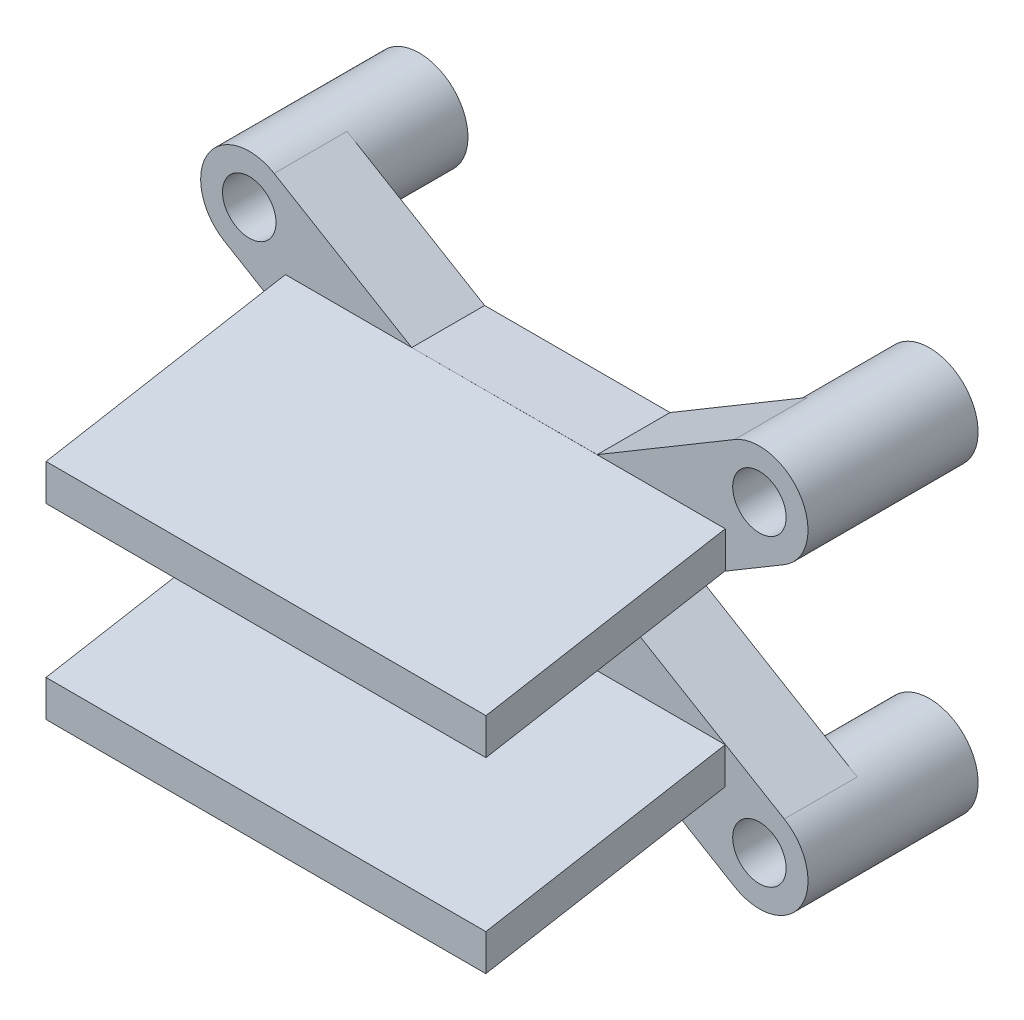
from build123d import *

# Parameters (mm, degrees)
CROQUIS1_R                   = 1.1
SALIENTE_EXTRUIR1_DEPTH      = 3
SALIENTE_EXTRUIR2_START      = 4
CROQUIS2_R                   = 2
CROQUIS2_R_2                 = 1.1
SALIENTE_EXTRUIR2_DEPTH      = 4
SALIENTE_EXTRUIR3_DEPTH      = 3
SALIENTE_EXTRUIR4_DEPTH      = 12.9
SALIENTE_EXTRUIR4_DEPTH_BACK = 5.2


with BuildPart() as part:
    # Croquis1 → Saliente-Extruir1 (new body)
    with BuildSketch(Plane.XY):
        with BuildLine():
            ThreePointArc((-1.022968, 1.718586), (-1.718586, -1.022968), (1.022968, -1.718586))
            Line((1.022968, -1.718586), (10.505387, 3.925711))
            Line((10.505387, 3.925711), (19.976173, -1.718074))
            ThreePointArc((19.976173, -1.718074), (22.718074, -1.023827), (22.023827, 1.718074))
            Line((22.023827, 1.718074), (14.41452, 6.252576))
            Line((14.41452, 6.252576), (22.022968, 10.781414))
            ThreePointArc((22.022968, 10.781414), (22.718586, 13.522968), (19.977032, 14.218586))
            Line((19.977032, 14.218586), (10.506551, 8.581394))
            Line((10.506551, 8.581394), (1.03008, 14.228567))
            ThreePointArc((1.03008, 14.228567), (-1.711821, 13.53432), (-1.017574, 10.792419))
            Line((-1.017574, 10.792419), (6.597418, 6.25453))
            Line((6.597418, 6.25453), (-1.022968, 1.718586))
        make_face()
        Circle(CROQUIS1_R, mode=Mode.SUBTRACT)
        with Locations((21, 0)):
            Circle(CROQUIS1_R, mode=Mode.SUBTRACT)
        with Locations((0.006253, 12.510493)):
            Circle(CROQUIS1_R, mode=Mode.SUBTRACT)
        with Locations((21, 12.5)):
            Circle(CROQUIS1_R, mode=Mode.SUBTRACT)
    extrude(amount=SALIENTE_EXTRUIR1_DEPTH)

    # Croquis2 → Saliente-Extruir2 (add)
    # profile 1 of 4: a face of its own
    with BuildSketch(Plane(origin=(0, 0, 0), x_dir=(-1, 0, 0), z_dir=(0, 0, -1)).offset(SALIENTE_EXTRUIR2_START)):
        with Locations((-0.006253, 12.510493)):
            Circle(CROQUIS2_R)
        with Locations((-0.006253, 12.510493)):
            Circle(CROQUIS2_R_2, mode=Mode.SUBTRACT)
    # profile 2 of 4: a face of its own
    with BuildSketch(Plane(origin=(0, 0, 0), x_dir=(-1, 0, 0), z_dir=(0, 0, -1)).offset(SALIENTE_EXTRUIR2_START)):
        with Locations((-21, 0)):
            Circle(CROQUIS2_R)
        with Locations((-21, 0)):
            Circle(CROQUIS2_R_2, mode=Mode.SUBTRACT)
    # profile 3 of 4: a face of its own
    with BuildSketch(Plane(origin=(0, 0, 0), x_dir=(-1, 0, 0), z_dir=(0, 0, -1)).offset(SALIENTE_EXTRUIR2_START)):
        with Locations((-21, 12.5)):
            Circle(CROQUIS2_R)
        with Locations((-21, 12.5)):
            Circle(CROQUIS2_R_2, mode=Mode.SUBTRACT)
    # profile 4 of 4: a face of its own
    with BuildSketch(Plane(origin=(0, 0, 0), x_dir=(-1, 0, 0), z_dir=(0, 0, -1)).offset(SALIENTE_EXTRUIR2_START)):
        Circle(CROQUIS2_R)
        Circle(CROQUIS2_R_2, mode=Mode.SUBTRACT)
    extrude(amount=-SALIENTE_EXTRUIR2_DEPTH)

    # Croquis3 → Saliente-Extruir3 (add)
    with BuildSketch(Plane.XY.offset(3)):
        Polygon((9.208161, 9.353553), (9.210798, 9.353553), (6.693662, 10.853553), (6.688161, 10.853553), (1.708161, 10.792419), (1.708161, 9.353553), align=None)
        Polygon((6.693662, 10.853553), (9.210798, 9.353553), (11.803777, 9.353553), (14.323777, 10.853553), align=None)
        Polygon((14.323777, 10.853553), (11.803777, 9.353553), (19.303777, 9.353553), (19.303777, 10.792419), align=None)
        Polygon((6.685862, 1.655462), (6.691363, 1.655459), (9.209249, 3.154201), (9.206611, 3.154202), (1.706612, 3.157951), (1.705893, 1.719085), align=None)
        Polygon((6.691363, 1.655459), (14.321477, 1.651645), (11.802227, 3.152905), (9.209249, 3.154201), align=None)
        Polygon((11.802227, 3.152905), (14.321477, 1.651645), (19.301507, 1.71029), (19.302226, 3.149156), align=None)
    extrude(amount=-SALIENTE_EXTRUIR3_DEPTH)

    # Croquis5 → Saliente-Extruir4 (add, two sides: drawn at the far end of the back side and taken through both)
    with BuildSketch(Plane(origin=(6.691363, 1.655459, 0), x_dir=(0, 0, -1), z_dir=(0.9999998750863595, -0.0004998272358196119, 0)).offset(-SALIENTE_EXTRUIR4_DEPTH_BACK)):
        Polygon((-3, 9.198094), (-12.848078, 7.461612), (-12.848078, 5.96287), (-3, 7.699352), align=None)
        Polygon((-3, 1.5), (-12.848078, -0.236482), (-12.848078, -1.736482), (-3, 0), align=None)
    extrude(amount=SALIENTE_EXTRUIR4_DEPTH + SALIENTE_EXTRUIR4_DEPTH_BACK)


solid = part.part
